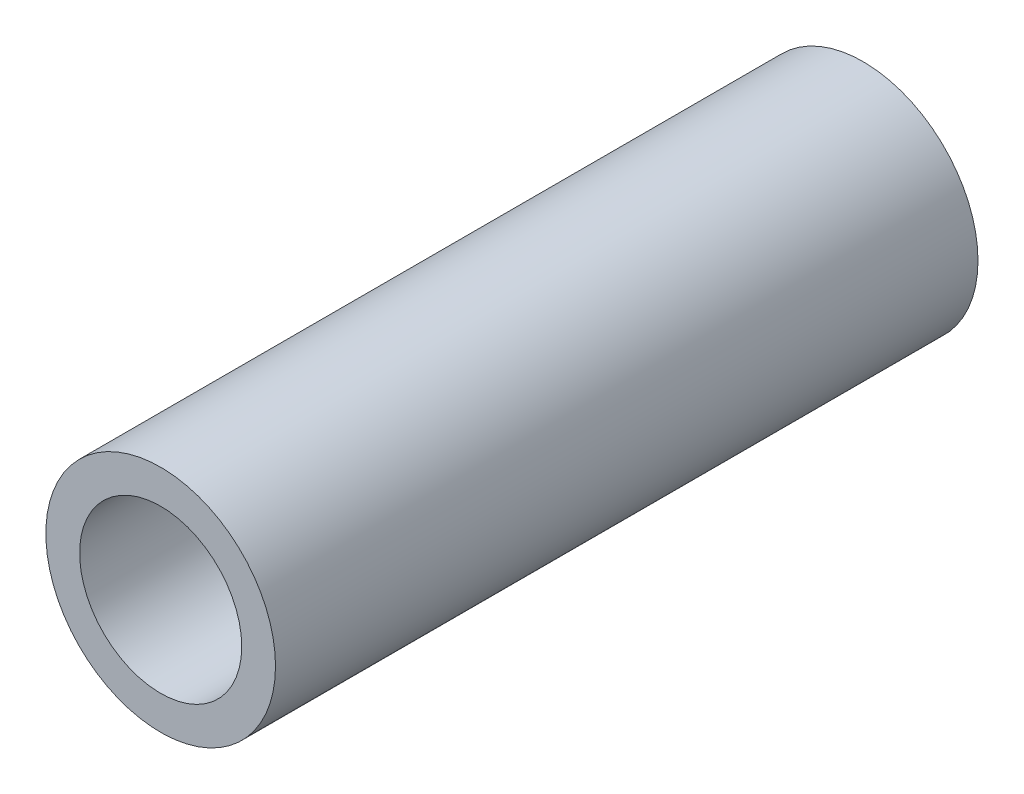
from build123d import *

# Parameters (mm, degrees)
SWEEP1_PROFILE_R     = 13.49375
CUT_SWEEP1_PROFILE_R = 9.525


with BuildPart() as part:
    # Sweep1: sweep along a curve in space
    with BuildLine() as sweep1_path:
        Line((0, 0, 0), (0, 0, 82.55))
    # Sweep1 profile (on start of the path) → Sweep1 (sweep)
    with BuildSketch(Plane.XY):
        Circle(SWEEP1_PROFILE_R)
    sweep(path=sweep1_path.line)

    # Cut-Sweep1: sweep along a curve in space
    with BuildLine() as cut_sweep1_path:
        Line((0, 0, 0), (0, 0, 82.55))
    # Cut-Sweep1 profile (on start of the path) → Cut-Sweep1 (sweep, cut)
    with BuildSketch(Plane.XY):
        Circle(CUT_SWEEP1_PROFILE_R)
    sweep(path=cut_sweep1_path.line, mode=Mode.SUBTRACT)


solid = part.part
